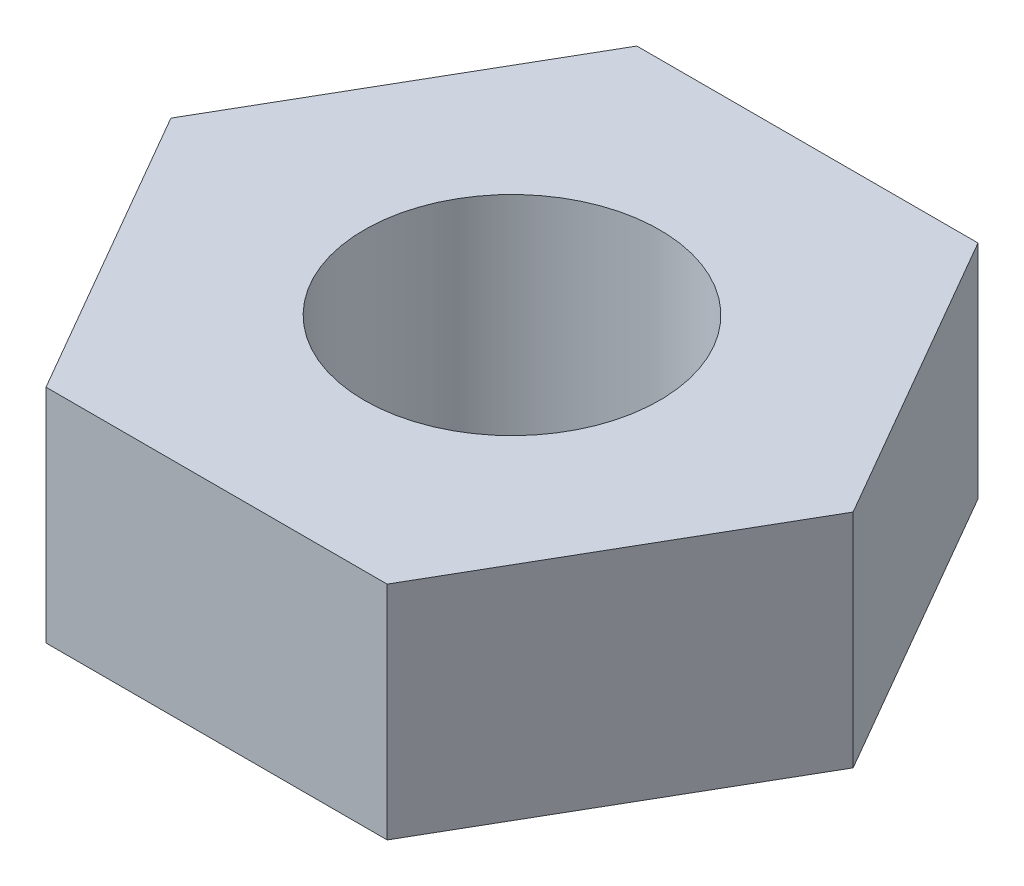
from build123d import *

# Parameters (mm, degrees)
SKETCH1_R           = 1
BOSS_EXTRUDE1_DEPTH = 1.5


with BuildPart() as part:
    # Sketch1 → Boss-Extrude1 (new body)
    with BuildSketch(Plane(origin=(0, 0, 0), x_dir=(1, 0, 0), z_dir=(0, 1, 0))):
        Polygon((2.309401077, 0), (1.154700538, 2), (-1.154700538, 2), (-2.309401077, 0), (-1.154700538, -2), (1.154700538, -2), align=None)
        with Locations(Location((0, 0, 0), (0, 0, 270))):
            Circle(SKETCH1_R, mode=Mode.SUBTRACT)
    extrude(amount=BOSS_EXTRUDE1_DEPTH)


solid = part.part
